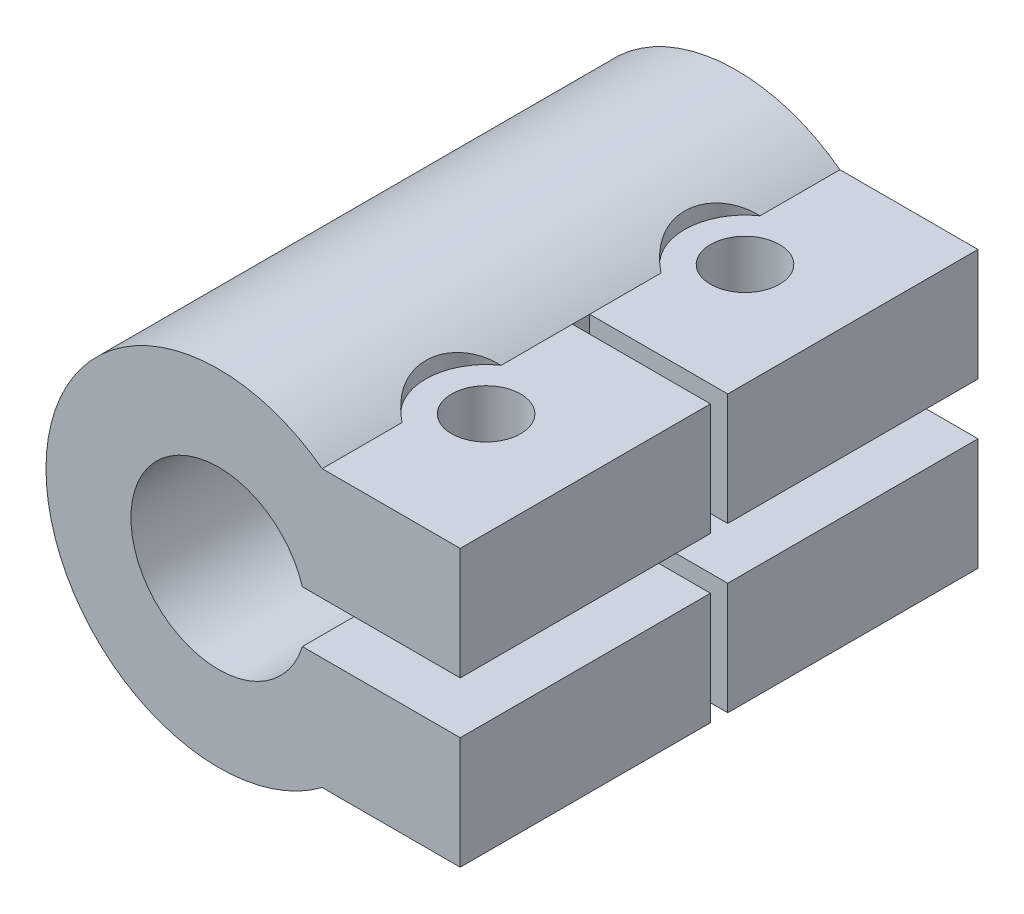
from build123d import *

# Parameters (mm, degrees)
BOSS_EXTRUDE1_DEPTH     = 30
SKETCH3_R               = 2
CUT_EXTRUDE2_DEPTH      = 43.426406839
SKETCH8_R               = 3.5
CUT_EXTRUDE5_DEPTH      = 10
CUT_EXTRUDE6_DEPTH      = 43.426406952
CUT_EXTRUDE6_DEPTH_BACK = 43.426406952
SKETCH9_W               = 8.000001136
SKETCH9_H               = 1
CUT_EXTRUDE7_START      = -3
CUT_EXTRUDE7_DEPTH      = 46.426406952
SKETCH12_R              = 5.08
CUT_EXTRUDE8_DEPTH      = 15


with BuildPart() as part:
    # Sketch1 → Boss-Extrude1 (new body)
    with BuildSketch(Plane.XY):
        with BuildLine():
            Line((7.999999523, 12.236067772), (7.999999523, 7.763931751))
            ThreePointArc((7.999999523, 7.763931751), (10.474207269, 7.037715521), (12.598076062, 8.499999806))
            Line((12.598076062, 8.499999806), (23.999999754, 8.499999806))
            Line((23.999999754, 8.499999806), (23.999999754, 1.999999464))
            Line((23.999999754, 1.999999464), (15.9999988, 1.999999464))
            ThreePointArc((15.9999988, 1.999999464), (-3.4e-08, 9.99999976), (15.999998799, 18.00000006))
            Line((15.999998799, 18.00000006), (23.999999935, 18.00000006))
            Line((23.999999935, 18.00000006), (23.999999935, 11.500000167))
            Line((23.999999935, 11.500000167), (12.598075802, 11.500000167))
            ThreePointArc((12.598075802, 11.500000167), (10.474207012, 12.962284044), (7.999999523, 12.236067772))
        make_face()
    extrude(amount=BOSS_EXTRUDE1_DEPTH)

    # Sketch3 → Cut-Extrude2 (cut, through all)
    with BuildSketch(Plane(origin=(0, 18.00000006, 0), x_dir=(1, 0, 0), z_dir=(0, 1, 0))):
        with Locations(Location((17.999999935, -22.5, 0), (0, 0, 180))):
            Circle(SKETCH3_R)
    cut_extrude2 = extrude(amount=-CUT_EXTRUDE2_DEPTH, mode=Mode.SUBTRACT)

    # Sketch8 → Cut-Extrude5 (cut)
    with BuildSketch(Plane(origin=(0, 18.00000006, 0), x_dir=(1, 0, 0), z_dir=(0, 1, 0))):
        with Locations((17.999999935, -22.5)):
            Circle(SKETCH8_R)
    cut_extrude5 = extrude(amount=CUT_EXTRUDE5_DEPTH, mode=Mode.SUBTRACT)

    # Sketch9 → Cut-Extrude6 (cut, two sides: drawn at the far end of the back side and taken through both)
    with BuildSketch(Plane(origin=(0, 18.00000006, 0), x_dir=(1, 0, 0), z_dir=(0, 1, 0)).offset(-CUT_EXTRUDE6_DEPTH_BACK)):
        with Locations((19.999999367, -15)):
            Rectangle(SKETCH9_W, SKETCH9_H)
    extrude(amount=CUT_EXTRUDE6_DEPTH + CUT_EXTRUDE6_DEPTH_BACK, mode=Mode.SUBTRACT)

    # Sketch10 → Cut-Extrude7 (cut)
    with BuildSketch(Plane.XZ.offset(-1.999999464).offset(CUT_EXTRUDE7_START)):
        Polygon((15.067996564, 20.882381514), (17.934896952, 19.152001354), (20.866900323, 20.76961984), (20.932003306, 24.117618486), (18.065102919, 25.847998646), (15.133099548, 24.23038016), align=None)
    cut_extrude7 = extrude(amount=CUT_EXTRUDE7_DEPTH, mode=Mode.SUBTRACT)

    # Mirror1: Cut-Extrude7 across plane
    add(cut_extrude7.mirror(Plane.XY.offset(15)), mode=Mode.SUBTRACT)

    # Mirror2: Cut-Extrude2, Cut-Extrude5 across plane
    add(cut_extrude2.mirror(Plane.XY.offset(15)), mode=Mode.SUBTRACT)
    add(cut_extrude5.mirror(Plane.XY.offset(15)), mode=Mode.SUBTRACT)

    # Sketch12 → Cut-Extrude8 (cut)
    with BuildSketch(Plane.XY.offset(30)):
        with Locations((9.999999677, 9.999999762)):
            Circle(SKETCH12_R)
    extrude(amount=-CUT_EXTRUDE8_DEPTH, mode=Mode.SUBTRACT)


solid = part.part
